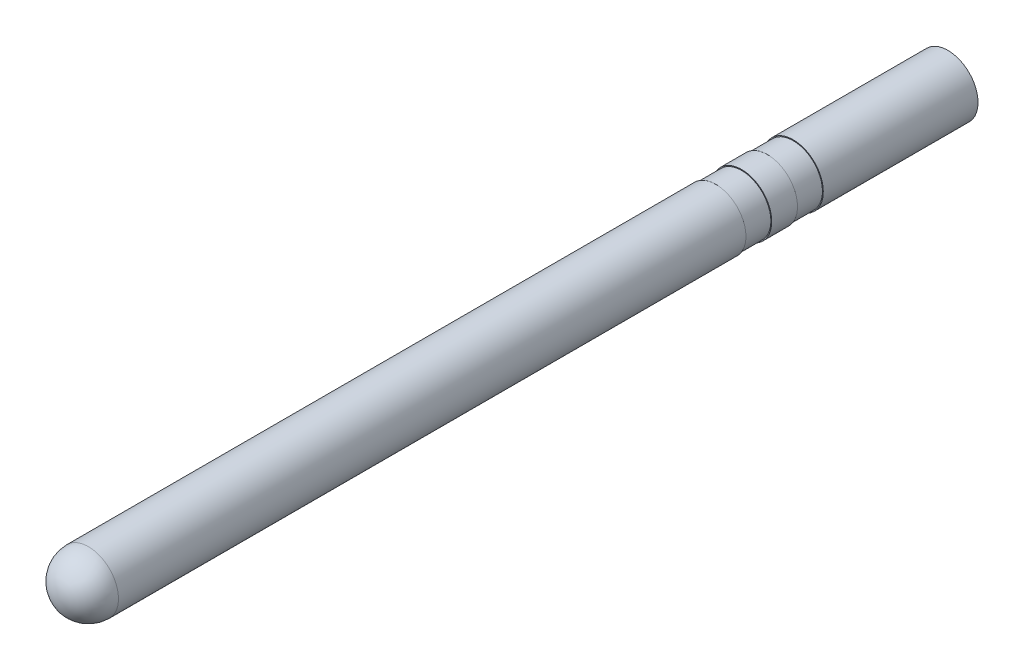
from build123d import *


with BuildPart() as part:
    # Sketch1 → Revolve2 (revolve)
    with BuildSketch(Plane(origin=(0, 0, 0), x_dir=(0, 0, -1), z_dir=(1, 0, 0))):
        with BuildLine():
            Line((-135.536912752, 0), (899.463087248, 0))
            Line((899.463087248, 0), (899.463087248, -35))
            Line((899.463087248, -35), (719.463087248, -35))
            Line((719.463087248, -35), (719.463087248, -34))
            Line((719.463087248, -34), (689.463087248, -34))
            Line((689.463087248, -34), (689.463087248, -35))
            Line((689.463087248, -35), (659.463087248, -35))
            Line((659.463087248, -35), (659.463087248, -34))
            Line((659.463087248, -34), (629.463087248, -34))
            Line((629.463087248, -34), (629.463087248, -35))
            Line((629.463087248, -35), (-100.536912752, -35))
            ThreePointArc((-100.536912752, -35), (-125.285650093, -24.748737342), (-135.536912752, 0))
        make_face()
    revolve(axis=Axis((0, 0, 135.536912752), (0, 0, -1)))


solid = part.part
